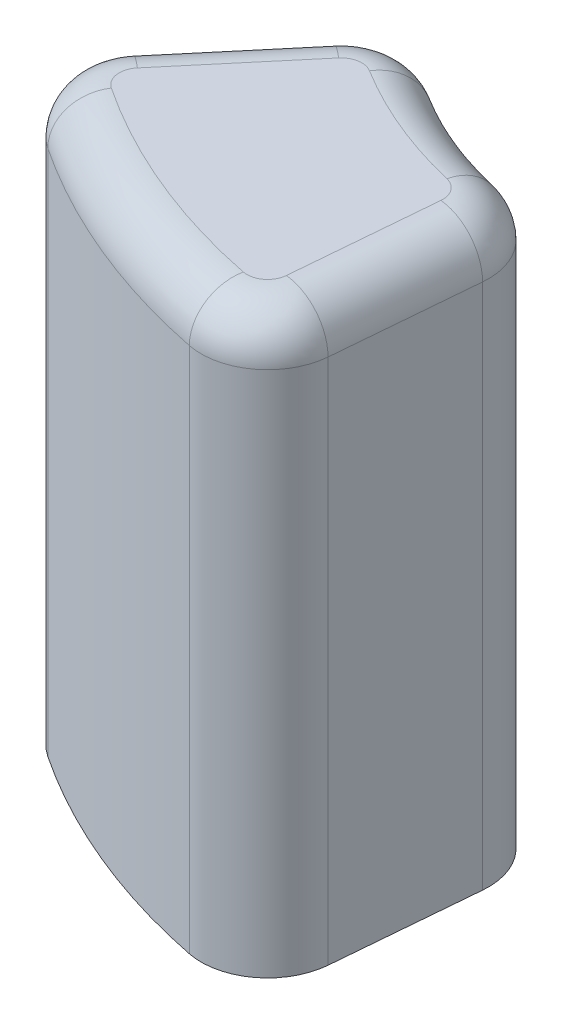
from build123d import *

# Parameters (mm, degrees)
BOSS_EXTRUDE1_DEPTH = 25
FILLET1_R           = 2


with BuildPart() as part:
    # Sketch1 → Boss-Extrude1 (new body)
    with BuildSketch(Plane(origin=(0, 0, 0), x_dir=(-1, 0, 0), z_dir=(0, 1, 0))):
        with BuildLine():
            Line((1.837857672, 20.196095642), (2.372417379, 26.409673621))
            ThreePointArc((2.372417379, 26.409673621), (3.522331642, 28.481542299), (5.833566285, 29.004167449))
            ThreePointArc((5.833566285, 29.004167449), (11.321689347, 27.332975969), (16.384089207, 24.633997765))
            ThreePointArc((16.384089207, 24.633997765), (17.648827109, 22.630156287), (16.99690689, 20.352011723))
            Line((16.99690689, 20.352011723), (12.981234559, 15.580357805))
            ThreePointArc((12.981234559, 15.580357805), (11.222292108, 14.584351213), (9.239918516, 14.97944945))
            ThreePointArc((9.239918516, 14.97944945), (6.73522841, 16.260279772), (4.058461244, 17.125679325))
            ThreePointArc((4.058461244, 17.125679325), (2.377334792, 18.248052492), (1.837857672, 20.196095642))
        make_face()
    extrude(amount=BOSS_EXTRUDE1_DEPTH)

    # Fillet1
    fillet1_edges = [part.edges().sort_by_distance(p)[0] for p in [
        (-11.222292108, 25, 14.584351213),
        (-14.989070724, 25, 17.966184764),
        (-17.648827109, 25, 22.630156287),
        (-11.321689347, 25, 27.332975969),
        (-3.522331642, 25, 28.481542299),
        (-2.105137526, 25, 23.302884632),
        (-2.377334792, 25, 18.248052492),
        (-6.73522841, 25, 16.260279772),
    ]]
    fillet(fillet1_edges, radius=FILLET1_R)


solid = part.part
